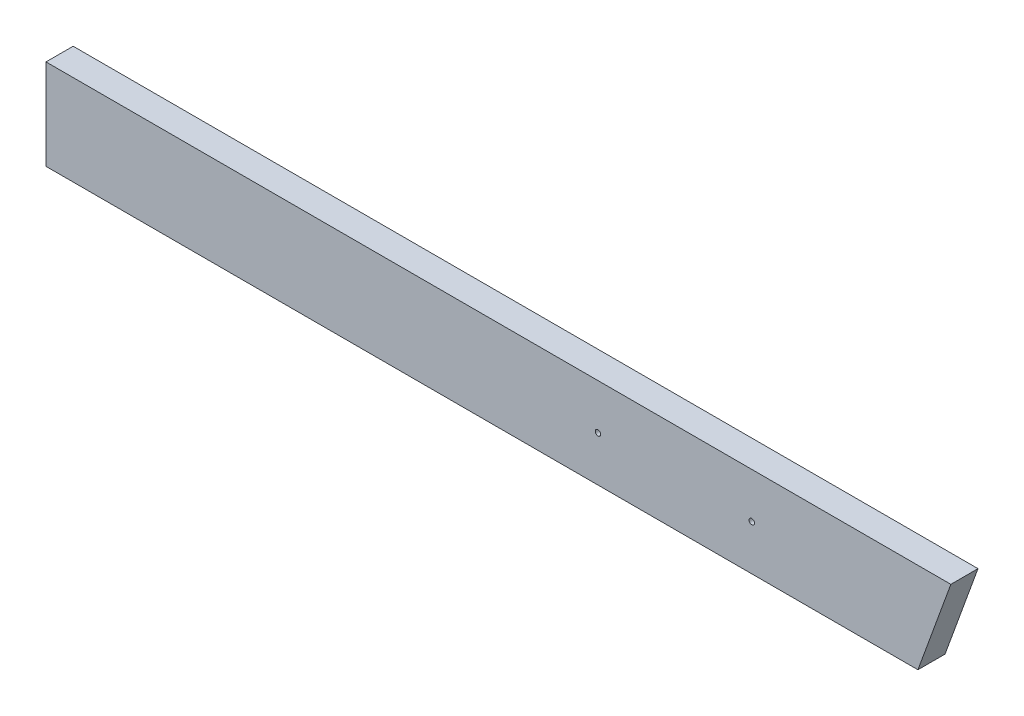
from build123d import *

# Parameters (mm, degrees)
BOSS_EXTRUDE1_DEPTH = 30
SKETCH3_R           = 3
CUT_EXTRUDE2_DEPTH  = 504.388517946


with BuildPart() as part:
    # Sketch1 → Boss-Extrude1 (new body)
    with BuildSketch(Plane.XY):
        Polygon((500, 50), (463.602976573, -50), (-500, -50), (-500, 50), align=None)
    extrude(amount=BOSS_EXTRUDE1_DEPTH)

    # Sketch3 → Cut-Extrude2 (cut, through all)
    with BuildSketch(Plane.XY.offset(30)):
        with Locations((110, 0)):
            Circle(SKETCH3_R)
        with Locations((280, 0)):
            Circle(SKETCH3_R)
    extrude(amount=-CUT_EXTRUDE2_DEPTH, mode=Mode.SUBTRACT)


solid = part.part
